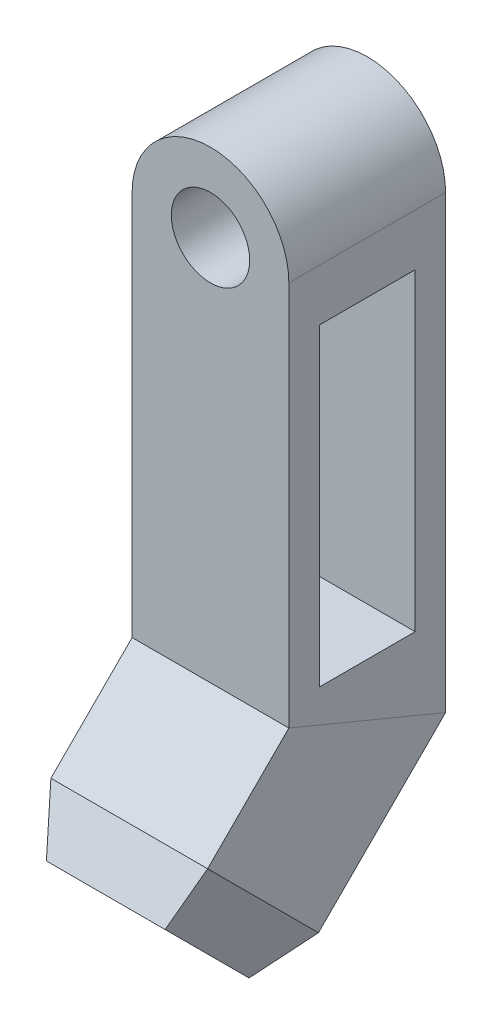
from build123d import *

# Parameters (mm, degrees)
SKETCH11_W          = 38.1
SKETCH11_H          = 38.1
SKETCH12_W          = 38.1
SKETCH12_H          = 38.1
BOSS_EXTRUDE5_DEPTH = 12.7
BOSS_EXTRUDE5_TAPER = 20
BOSS_EXTRUDE6_DEPTH = 38.1
SKETCH14_R          = 9.525
CUT_EXTRUDE2_DEPTH  = 38.1
SKETCH15_R          = 12.065
CUT_EXTRUDE3_DEPTH  = 12.7
SKETCH16_W          = 23.310601064
SKETCH16_H          = 76.2
CUT_EXTRUDE4_DEPTH  = 59.830675793


with BuildPart() as part:
    # Sweep1: sweep along a path in Sketch10
    with BuildLine(Plane(origin=(0, 0, 0), x_dir=(0, 0, -1), z_dir=(1, 0, 0))) as sweep1_path:
        Line((0, 96.393), (0, -5.207))
        Line((0, -5.207), (-25.324322261, -30.531322261))
    # Sketch11 → Sweep1 (sweep)
    with BuildSketch(Plane(origin=(0, 96.393, 0), x_dir=(1, 0, 0), z_dir=(0, 1, 0))):
        Rectangle(SKETCH11_W, SKETCH11_H)
    sweep(path=sweep1_path.line, transition=Transition.RIGHT)

    # Sketch12 → Boss-Extrude5 (add)
    with BuildSketch(Plane(origin=(0, -27.927822261, 27.927822261), x_dir=(1, 0, 0), z_dir=(0, -0.7071067811865461, 0.7071067811865489))):
        with Locations((0, -3.68190501)):
            Rectangle(SKETCH12_W, SKETCH12_H)
    extrude(amount=BOSS_EXTRUDE5_DEPTH, taper=BOSS_EXTRUDE5_TAPER)

    # Sketch13 → Boss-Extrude6 (add)
    with BuildSketch(Plane(origin=(0, 0, -19.05), x_dir=(-1, 0, 0), z_dir=(0, 0, -1))):
        with BuildLine():
            Line((-19.05, 96.393), (19.05, 96.393))
            ThreePointArc((19.05, 96.393), (0, 115.443), (-19.05, 96.393))
        make_face()
    extrude(amount=-BOSS_EXTRUDE6_DEPTH)

    # Sketch14 → Cut-Extrude2 (cut)
    with BuildSketch(Plane.XY.offset(19.05)):
        with Locations((0, 96.393)):
            Circle(SKETCH14_R)
    extrude(amount=-CUT_EXTRUDE2_DEPTH, mode=Mode.SUBTRACT)

    # Sketch15 → Cut-Extrude3 (cut)
    with BuildSketch(Plane(origin=(0, -36.908078382, 36.908078382), x_dir=(1, 0, 0), z_dir=(0, -0.7071067811865461, 0.7071067811865489))):
        with Locations(Location((0, -3.68190501, 0), (0, 0, 270))):
            Circle(SKETCH15_R)
    extrude(amount=-CUT_EXTRUDE3_DEPTH, mode=Mode.SUBTRACT)

    # Sketch16 → Cut-Extrude4 (cut)
    with BuildSketch(Plane(origin=(19.05, 0, 0), x_dir=(0, 0, -1), z_dir=(1, 0, 0))):
        with Locations((0, 45.72)):
            Rectangle(SKETCH16_W, SKETCH16_H)
    extrude(amount=-CUT_EXTRUDE4_DEPTH, mode=Mode.SUBTRACT)


solid = part.part
